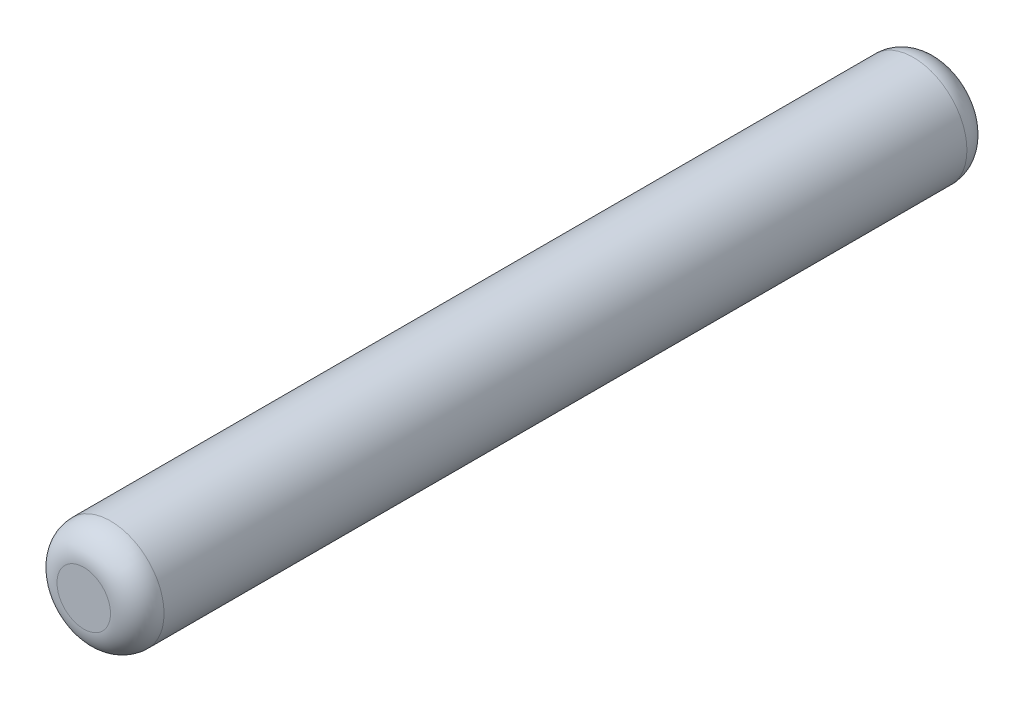
from build123d import *

# Parameters (mm, degrees)
SKETCH1_R           = 50
BOSS_EXTRUDE1_DEPTH = 400
FILLET1_R           = 25


with BuildPart() as part:
    # Sketch1 → Boss-Extrude1 (new, symmetric)
    with BuildSketch(Plane.XY):
        Circle(SKETCH1_R)
    extrude(amount=BOSS_EXTRUDE1_DEPTH, both=True)

    # Fillet1
    fillet1_edges = [part.edges().sort_by_distance(p)[0] for p in [
        (-50, 0, -400),
        (-50, 0, 400),
    ]]
    fillet(fillet1_edges, radius=FILLET1_R)


solid = part.part
